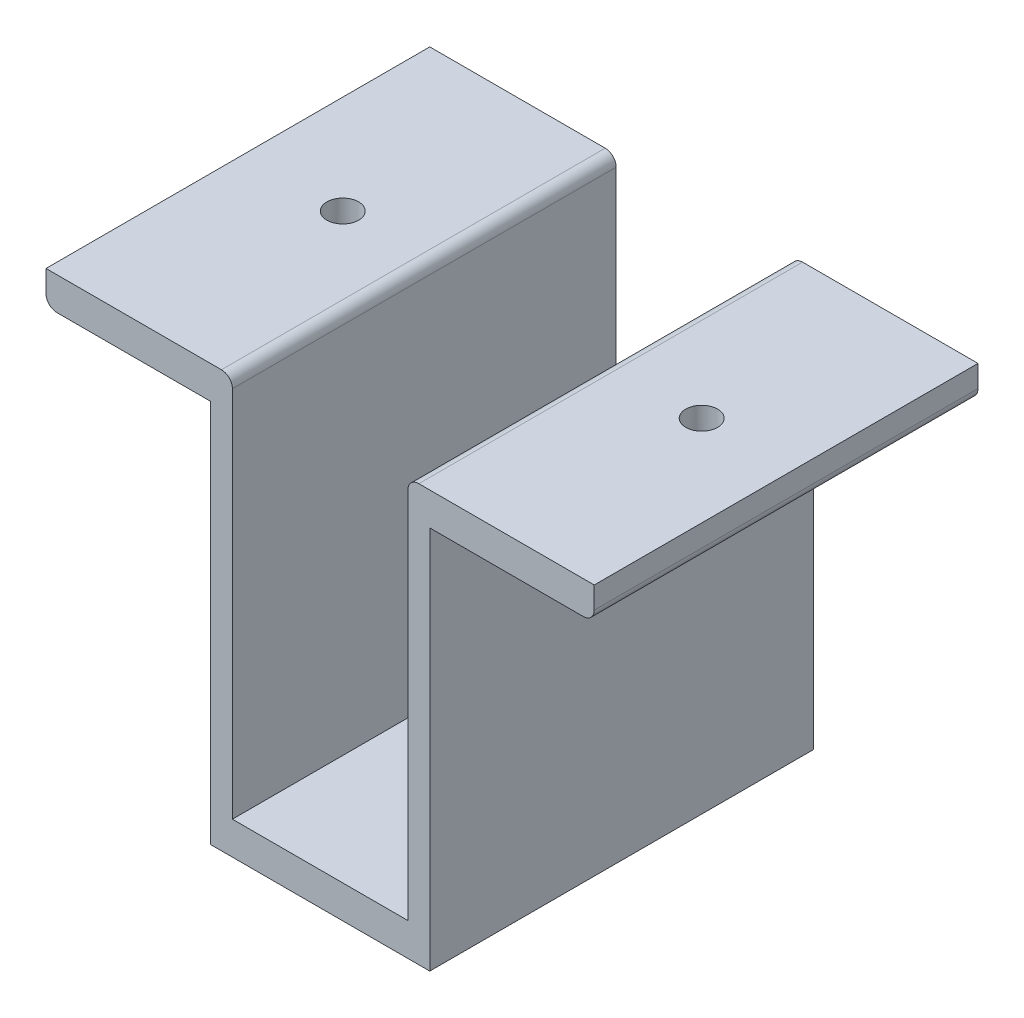
from build123d import *

# Parameters (mm, degrees)
SKETCH2_W           = 20
SKETCH2_H           = 35
BOSS_EXTRUDE1_DEPTH = 3
SKETCH3_W           = 2
SKETCH3_H           = 35
SKETCH3_W_2         = 2.000552232
BOSS_EXTRUDE2_DEPTH = 35
SKETCH4_W           = 35
SKETCH4_H           = 2.991859995
BOSS_EXTRUDE3_DEPTH = 15
SKETCH5_W           = 35
SKETCH5_H           = 2.991859995
BOSS_EXTRUDE4_DEPTH = 15
SKETCH6_W           = 15.999447768
SKETCH6_H           = 1.992266861
BOSS_EXTRUDE5_DEPTH = 5
SKETCH8_R           = 1.45
CUT_EXTRUDE1_DEPTH  = 56.358026135
FILLET1_R           = 1
FILLET3_R           = 1


with BuildPart() as part:
    # Sketch2 → Boss-Extrude1 (new body)
    with BuildSketch(Plane(origin=(0, 0, 0), x_dir=(1, 0, 0), z_dir=(0, 1, 0))):
        with Locations((10, 2.387459807)):
            Rectangle(SKETCH2_W, SKETCH2_H)
    extrude(amount=BOSS_EXTRUDE1_DEPTH)

    # Sketch3 → Boss-Extrude2 (add)
    with BuildSketch(Plane(origin=(0, 3, 0), x_dir=(1, 0, 0), z_dir=(0, 1, 0))):
        with Locations((1, 2.387459807)):
            Rectangle(SKETCH3_W, SKETCH3_H)
        with Locations((18.999723884, 2.387459807)):
            Rectangle(SKETCH3_W_2, SKETCH3_H)
    extrude(amount=BOSS_EXTRUDE2_DEPTH)

    # Sketch4 → Boss-Extrude3 (add)
    with BuildSketch(Plane(origin=(20, 0, 0), x_dir=(0, 0, -1), z_dir=(1, 0, 0))):
        with Locations((2.387459807, 36.504070003)):
            Rectangle(SKETCH4_W, SKETCH4_H)
    extrude(amount=BOSS_EXTRUDE3_DEPTH)

    # Sketch5 → Boss-Extrude4 (add)
    with BuildSketch(Plane.ZY):
        with Locations((-2.387459807, 36.504070003)):
            Rectangle(SKETCH5_W, SKETCH5_H)
    extrude(amount=BOSS_EXTRUDE4_DEPTH)

    # Sketch6 → Boss-Extrude5 (add)
    with BuildSketch(Plane(origin=(0, 3, 0), x_dir=(1, 0, 0), z_dir=(0, 1, 0))):
        with Locations((9.999723884, 18.891326377)):
            Rectangle(SKETCH6_W, SKETCH6_H)
    extrude(amount=BOSS_EXTRUDE5_DEPTH)

    # Sketch8 → Cut-Extrude1 (cut, through all)
    with BuildSketch(Plane(origin=(0, 38, 0), x_dir=(1, 0, 0), z_dir=(0, 1, 0))):
        with Locations(Location((-6.002072166, 2.955493098, 0), (0, 0, 270))):
            Circle(SKETCH8_R)
        with Locations(Location((26.730432143, 2.955493098, 0), (0, 0, 270))):
            Circle(SKETCH8_R)
    extrude(amount=-CUT_EXTRUDE1_DEPTH, mode=Mode.SUBTRACT)

    # Fillet1
    fillet1_edges = [part.edges().sort_by_distance(p)[0] for p in [
        (2, 38, -2.387459807),
        (17.999447768, 38, -2.387459807),
        (35, 35.008140005, -2.387459807),
        (-15, 35.008140005, -2.387459807),
    ]]
    fillet(fillet1_edges, radius=FILLET1_R)

    # Fillet3
    fillet3_edges = [part.edges().sort_by_distance(p)[0] for p in [
        (9.999723884, 8, -19.887459807),
    ]]
    fillet(fillet3_edges, radius=FILLET3_R)


solid = part.part
